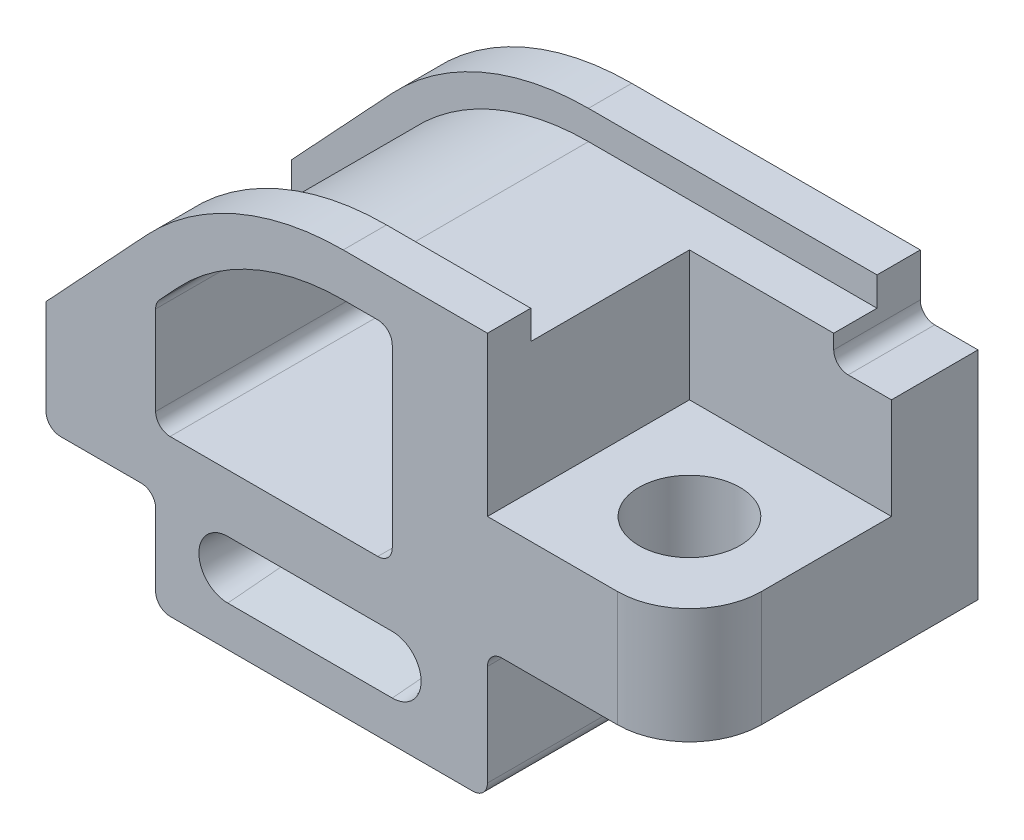
from build123d import *

# Parameters (mm, degrees)
BOSS_EXTRUDE1_DEPTH     = 50
CUT_EXTRUDE1_DEPTH      = 85
CUT_EXTRUDE2_DEPTH      = 35
SKETCH4_W               = 70
SKETCH4_H               = 70
CUT_EXTRUDE3_DEPTH      = 55
CUT_EXTRUDE4_DEPTH      = 244.831909315
CUT_EXTRUDE4_DEPTH_BACK = 244.831909315
SKETCH5_R               = 17.5
FILLET1_R               = 25
FILLET2_R               = 5
FILLET3_R               = 5
CUT_EXTRUDE5_DEPTH      = 25
CUT_EXTRUDE5_DRAFT      = -5
MIRROR1_COPY_1_DEPTH    = 25
MIRROR1_COPY_1_DRAFT    = -5


with BuildPart() as part:
    # Sketch1 → Boss-Extrude1 (new, symmetric)
    with BuildSketch(Plane.XY):
        with BuildLine():
            Line((0, 0), (38, 0))
            Line((38, 0), (38, -35))
            Line((38, -35), (153, -35))
            Line((153, -35), (153, 10))
            Line((153, 10), (223, 10))
            Line((223, 10), (223, 85))
            Line((223, 85), (203, 85))
            Line((203, 85), (203, 105))
            Line((203, 105), (103, 105))
            ThreePointArc((103, 105), (65.839360074, 97.270575779), (34.84292157, 75.364458857))
            Line((34.84292157, 75.364458857), (0, 38))
            Line((0, 38), (0, 0))
        make_face()
    extrude(amount=BOSS_EXTRUDE1_DEPTH, both=True)

    # Sketch2 → Cut-Extrude1 (cut)
    with BuildSketch(Plane.XY.offset(50)):
        with BuildLine():
            Line((120, 90), (120, 19))
            Line((120, 19), (38, 19))
            Line((38, 19), (38, 56.755823196))
            Line((38, 56.755823196), (45.813227094, 65.134483456))
            ThreePointArc((45.813227094, 65.134483456), (71.820596108, 83.514674664), (103, 90))
            Line((103, 90), (120, 90))
        make_face()
    extrude(amount=-CUT_EXTRUDE1_DEPTH, mode=Mode.SUBTRACT)

    # Sketch3 → Cut-Extrude2 (cut, symmetric)
    with BuildSketch(Plane.XY):
        with BuildLine():
            Line((203, 95), (103, 95))
            ThreePointArc((103, 95), (69.826850763, 88.099975036), (42.156458586, 68.544475257))
            Line((42.156458586, 68.544475257), (0, 23.337208144))
            Line((0, 23.337208144), (0, 38))
            Line((0, 38), (34.84292157, 75.364458857))
            ThreePointArc((34.84292157, 75.364458857), (65.839360074, 97.270575779), (103, 105))
            Line((103, 105), (203, 105))
            Line((203, 105), (203, 95))
        make_face()
    extrude(amount=CUT_EXTRUDE2_DEPTH, both=True, mode=Mode.SUBTRACT)

    # Sketch4 → Cut-Extrude3 (cut)
    with BuildSketch(Plane(origin=(0, 105, 0), x_dir=(1, 0, 0), z_dir=(0, 1, 0))):
        with Locations((188, -15)):
            Rectangle(SKETCH4_W, SKETCH4_H)
    extrude(amount=-CUT_EXTRUDE3_DEPTH, mode=Mode.SUBTRACT)

    # Sketch5 → Cut-Extrude4 (cut, two sides: drawn at the far end of the back side and taken through both)
    with BuildSketch(Plane(origin=(0, 50, 0), x_dir=(1, 0, 0), z_dir=(0, 1, 0)).offset(-CUT_EXTRUDE4_DEPTH_BACK)):
        with Locations(Location((188, -15, 0), (0, 0, 180))):
            Circle(SKETCH5_R)
    extrude(amount=CUT_EXTRUDE4_DEPTH + CUT_EXTRUDE4_DEPTH_BACK, mode=Mode.SUBTRACT)

    # Fillet1
    fillet1_edges = [part.edges().sort_by_distance(p)[0] for p in [
        (223, 30, 50),
    ]]
    fillet(fillet1_edges, radius=FILLET1_R)

    # Fillet2
    fillet2_edges = [part.edges().sort_by_distance(p)[0] for p in [
        (153, 10, 0),
        (153, -35, 0),
        (38, -35, 0),
        (38, 0, 0),
        (0, 0, 0),
        (203, 85, -35),
    ]]
    fillet(fillet2_edges, radius=FILLET2_R)

    # Fillet3
    fillet3_edges = [part.edges().sort_by_distance(p)[0] for p in [
        (38, 19, 7.5),
        (38, 56.755823196, 7.5),
        (120, 90, 7.5),
        (120, 19, 7.5),
    ]]
    fillet(fillet3_edges, radius=FILLET3_R)


with BuildPart() as cut_extrude5_tool:
    # Sketch6 → Cut-Extrude5 (with draft: the straight prism first)
    with BuildSketch(Plane.XY.offset(50)):
        with BuildLine():
            ThreePointArc((63, -1), (53, -11), (63, -21))
            Line((63, -21), (120, -21))
            ThreePointArc((120, -21), (130, -11), (120, -1))
            Line((120, -1), (63, -1))
        make_face()
    extrude(amount=-CUT_EXTRUDE5_DEPTH)
    # Cut-Extrude5: the draft: its side faces are tilted about the plane it starts from
    cut_extrude5_sides = [cut_extrude5_tool.faces().sort_by_distance(p)[0] for p in [
        (53, -11, 37.5),
        (91.5, -21, 37.5),
        (130, -11, 37.5),
        (91.5, -1, 37.5),
    ]]
    draft(cut_extrude5_sides, Plane.XY.offset(50), CUT_EXTRUDE5_DRAFT)


with BuildPart() as part_1:
    add(part.part)

    # Cut-Extrude5: cut by cut_extrude5_tool
    add(cut_extrude5_tool.part, mode=Mode.SUBTRACT)


with BuildPart() as mirror1_copy_1_tool:
    # Mirror1 copy 1 sketch → Mirror1 copy 1 (with draft: the straight prism first)
    with BuildSketch(Plane(origin=(0, 0, -50), x_dir=(1, 0, 0), z_dir=(0, 0, -1))):
        with BuildLine():
            ThreePointArc((63, 1), (53, 11), (63, 21))
            Line((63, 21), (120, 21))
            ThreePointArc((120, 21), (130, 11), (120, 1))
            Line((120, 1), (63, 1))
        make_face()
    extrude(amount=-MIRROR1_COPY_1_DEPTH)
    # Mirror1 copy 1: the draft: its side faces are tilted about the plane it starts from
    mirror1_copy_1_sides = [mirror1_copy_1_tool.faces().sort_by_distance(p)[0] for p in [
        (53, -11, -37.5),
        (91.5, -21, -37.5),
        (130, -11, -37.5),
        (91.5, -1, -37.5),
    ]]
    draft(mirror1_copy_1_sides, Plane(origin=(0, 0, -50), x_dir=(1, 0, 0), z_dir=(0, 0, -1)), MIRROR1_COPY_1_DRAFT)


with BuildPart() as part_2:
    add(part_1.part)

    # Mirror1 copy 1: cut by mirror1_copy_1_tool
    add(mirror1_copy_1_tool.part, mode=Mode.SUBTRACT)


solid = part_2.part
